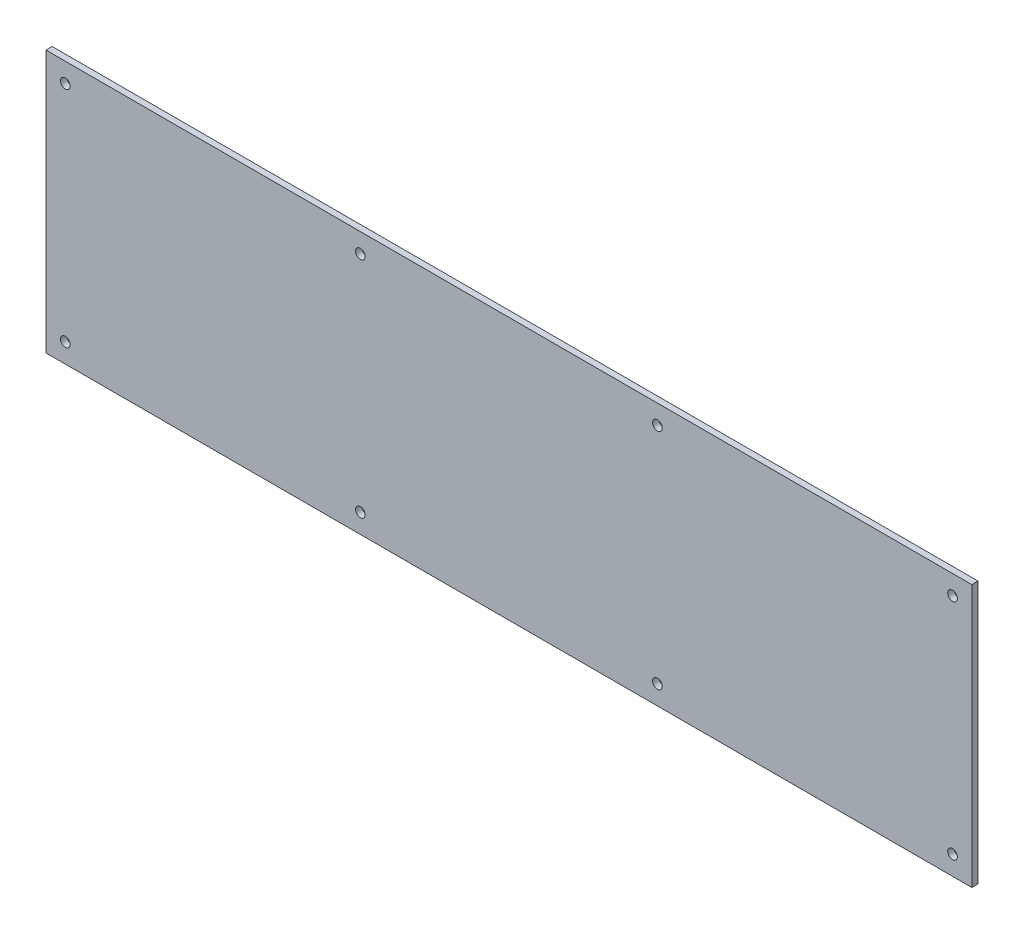
from build123d import *

# Parameters (mm, degrees)
SKETCH1_W          = 304.8
SKETCH1_H          = 86.36
EXTRUDE1_DEPTH     = 2.032
SKETCH2_R          = 1.5875
CUT_EXTRUDE1_DEPTH = 382.005418628


with BuildPart() as part:
    # Sketch1 → Extrude1 (new body)
    with BuildSketch(Plane.XY):
        with Locations((152.4, 185.42)):
            Rectangle(SKETCH1_W, SKETCH1_H)
    extrude(amount=EXTRUDE1_DEPTH)

    # Sketch2 → Cut-Extrude1 (cut, through all)
    with BuildSketch(Plane.XY.offset(2.032)):
        with Locations((6.35, 222.25)):
            Circle(SKETCH2_R)
        with Locations((6.35, 148.59)):
            Circle(SKETCH2_R)
        with Locations((103.505, 222.25)):
            Circle(SKETCH2_R)
        with Locations((103.505, 148.59)):
            Circle(SKETCH2_R)
        with Locations(Location((201.295, 148.59, 0), (0, 0, 180))):
            Circle(SKETCH2_R)
        with Locations(Location((201.295, 222.25, 0), (0, 0, 180))):
            Circle(SKETCH2_R)
        with Locations(Location((298.45, 148.59, 0), (0, 0, 180))):
            Circle(SKETCH2_R)
        with Locations(Location((298.45, 222.25, 0), (0, 0, 180))):
            Circle(SKETCH2_R)
    extrude(amount=-CUT_EXTRUDE1_DEPTH, mode=Mode.SUBTRACT)


solid = part.part
